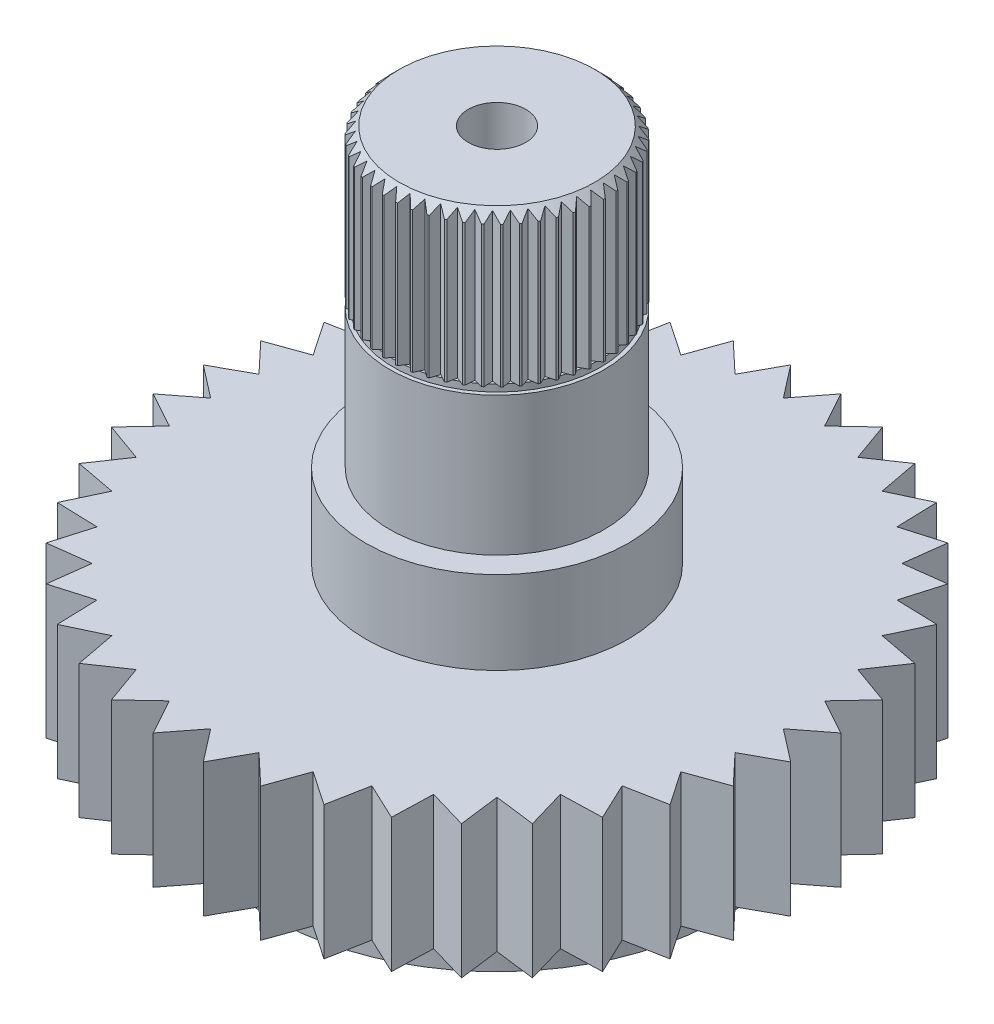
from build123d import *

# Parameters (mm, degrees)
CUT_EXTRUDE1_DEPTH    = 2.032
CUT_EXTRUDE2_DEPTH    = 16.699974027
CIRPATTERN1_COUNT     = 40
CHAMFER1_SIZE         = 0.254
CUT_EXTRUDE3_DEPTH    = 4
CIRPATTERN2_COUNT     = 50
CROQUIS1_R            = 0.765
CORTAR_EXTRUIR1_DEPTH = 2.54


with BuildPart() as part:
    # Sketch1 → Revolve1 (revolve)
    with BuildSketch(Plane.XY, mode=Mode.PRIVATE) as revolve1_sk:
        Polygon((6.016, 0), (8.509, 0), (8.509, 3.556), (3.4925, 3.556), (3.4925, 5.7658), (2.8575, 5.7658), (2.8575, 9.452083414), (2.755528071, 9.452083414), (2.755528071, 9.6398), (2.8575, 9.6398), (2.8575, 13.6398), (0, 13.6398), (0, 0.9398), (5, 0.9398), (5, -1.6002), (6.016, -1.6002), align=None)
    revolve(revolve1_sk.sketch.rotate(Axis((0, 0, 0), (0, 1, 0)), 90), axis=Axis((0, 0, 0), (0, 1, 0)))

    # Sketch2 → Cut-Extrude1 (cut)
    with BuildSketch(Plane.XZ.offset(-0.9398)):
        with BuildLine():
            Line((0, 1.5875), (0, -1.5875))
            ThreePointArc((0, -1.5875), (1.5875, 0), (0, 1.5875))
        make_face()
    extrude(amount=-CUT_EXTRUDE1_DEPTH, mode=Mode.SUBTRACT)

    # Sketch3 → Cut-Extrude2 (cut, through all)
    with BuildSketch(Plane(origin=(0, 3.556, 0), x_dir=(-1, 0, 0), z_dir=(0, 1, 0))):
        with BuildLine():
            Line((0.667608446, -8.482769593), (0, -7.62))
            Line((0, -7.62), (-0.667608446, -8.482769593))
            ThreePointArc((-0.667608446, -8.482769593), (0, -8.509), (0.667608446, -8.482769593))
        make_face()
    cut_extrude2 = extrude(amount=-CUT_EXTRUDE2_DEPTH, mode=Mode.SUBTRACT)

    # CirPattern1: Cut-Extrude2 ×40 about axis
    cirpattern1_axis = Axis((0, 0, 0), (0, 1, 0))
    for i in range(1, CIRPATTERN1_COUNT):
        add(cut_extrude2.rotate(cirpattern1_axis, i * 360 / CIRPATTERN1_COUNT), mode=Mode.SUBTRACT)

    # Chamfer1
    chamfer1_edges = [part.edges().sort_by_distance(p)[0] for p in [
        (0, 13.6398, 2.8575),
    ]]
    chamfer(chamfer1_edges, length=CHAMFER1_SIZE)

    # Sketch4 → Cut-Extrude3 (cut)
    with BuildSketch(Plane(origin=(0, 13.6398, 0), x_dir=(-1, 0, 0), z_dir=(0, 1, 0))):
        with BuildLine():
            Line((0.155479421, -2.85326697), (0, -2.667))
            Line((0, -2.667), (-0.155479421, -2.85326697))
            ThreePointArc((-0.155479421, -2.85326697), (0, -2.8575), (0.155479421, -2.85326697))
        make_face()
    cut_extrude3 = extrude(amount=-CUT_EXTRUDE3_DEPTH, mode=Mode.SUBTRACT)

    # CirPattern2: Cut-Extrude3 ×50 about axis
    cirpattern2_axis = Axis((0, 0, 0), (0, 1, 0))
    for i in range(1, CIRPATTERN2_COUNT):
        add(cut_extrude3.rotate(cirpattern2_axis, i * 360 / CIRPATTERN2_COUNT), mode=Mode.SUBTRACT)

    # Croquis1 → Cortar-Extruir1 (cut)
    with BuildSketch(Plane(origin=(0, 13.6398, 0), x_dir=(1, 0, 0), z_dir=(0, 1, 0))):
        with Locations(Location((0, 0, 0), (0, 0, 270))):
            Circle(CROQUIS1_R)
    extrude(amount=-CORTAR_EXTRUIR1_DEPTH, mode=Mode.SUBTRACT)


solid = part.part
